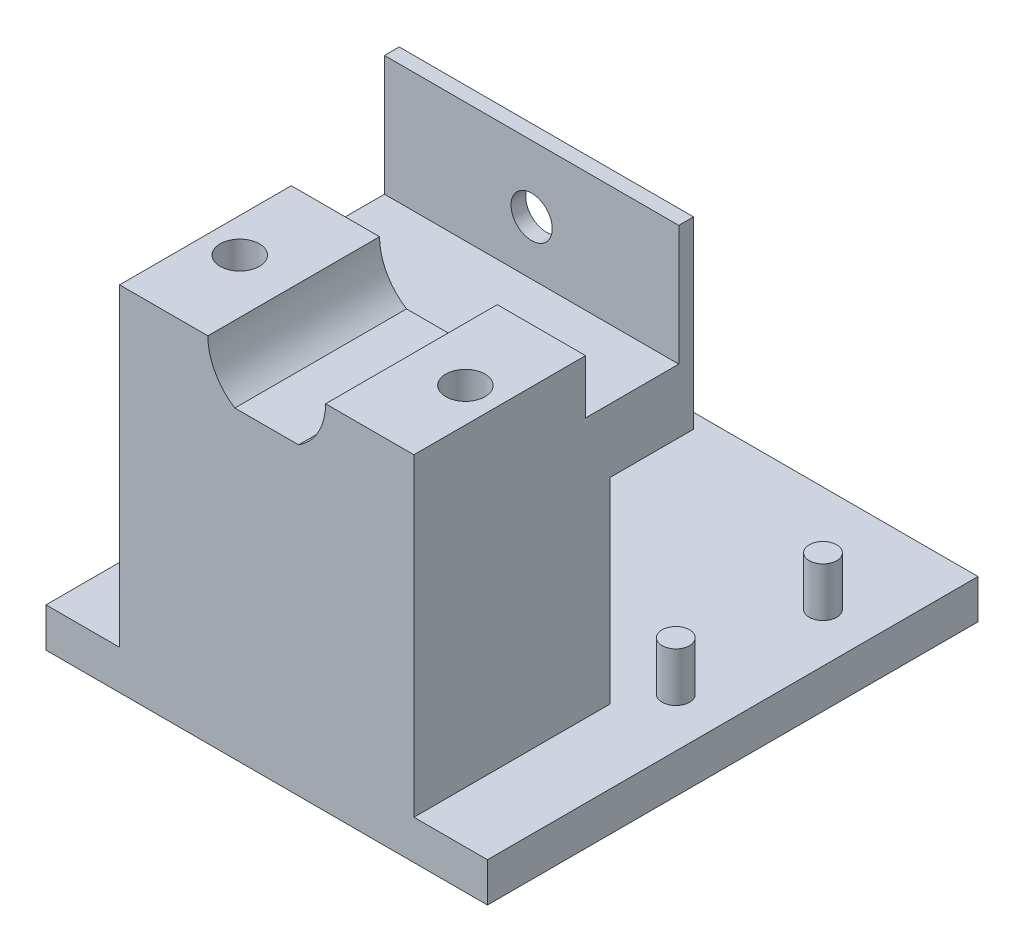
from build123d import *

# Parameters (mm, degrees)
SKETCH_2_W          = 50
SKETCH_2_H          = 4
EXTRUDE_2_DEPTH     = 22.5
SKETCH_15_R         = 1.4
EXTRUDE_8_DEPTH     = 5
SKETCH_3_W          = 30
SKETCH_3_H          = 20
EXTRUDE_4_DEPTH     = 20
EXTRUDE_9_DEPTH     = 17.5
EXTRUDE_10_DEPTH    = 15
CUT_EXTRUDE_1_REACH = 58.089
SKETCH_19_R         = 2.1
SKETCH_20_R         = 2
CUT_EXTRUDE_2_DEPTH = 10


with BuildPart() as part:
    # 草圖2 → 填料-伸長2 (new, symmetric)
    with BuildSketch(Plane(origin=(0, 0, 0), x_dir=(0, 0, -1), z_dir=(1, 0, 0))):
        with Locations((25, 2)):
            Rectangle(SKETCH_2_W, SKETCH_2_H)
    extrude(amount=EXTRUDE_2_DEPTH, both=True)

    # 草圖15 → 填料-伸長8 (add)
    with BuildSketch(Plane(origin=(0, 4, 0), x_dir=(1, 0, 0), z_dir=(0, 1, 0))):
        with Locations(Location((17.5, 39.2, 0), (0, 0, 90))):
            Circle(SKETCH_15_R)
        with Locations(Location((17.5, 24.2, 0), (0, 0, 90))):
            Circle(SKETCH_15_R)
    extrude(amount=EXTRUDE_8_DEPTH)

    # 草圖3 → 填料-伸長4 (add)
    with BuildSketch(Plane(origin=(0, 4, 0), x_dir=(1, 0, 0), z_dir=(0, 1, 0))):
        with Locations((0, 10)):
            Rectangle(SKETCH_3_W, SKETCH_3_H)
    extrude(amount=EXTRUDE_4_DEPTH)

    # 草圖16 → 填料-伸長9 (add)
    with BuildSketch(Plane(origin=(0, 0, 0), x_dir=(-1, 0, 0), z_dir=(0, 0, -1))):
        with BuildLine():
            Line((-15, 24), (-15, 36.000002525))
            Line((-15, 36.000002525), (-6, 36.000002525))
            ThreePointArc((-6, 36.000002525), (-5.267141914, 33.146824473), (-3.25, 31.000002525))
            Line((-3.25, 31.000002525), (3.25, 31.000002525))
            ThreePointArc((3.25, 31.000002525), (5.267141914, 33.146824473), (6, 36.000002525))
            Line((6, 36.000002525), (15, 36.000002525))
            Line((15, 36.000002525), (15, 24))
            Line((15, 24), (-15, 24))
        make_face()
    extrude(amount=EXTRUDE_9_DEPTH)

    # 草圖18 → 填料-伸長10 (add, symmetric)
    with BuildSketch(Plane(origin=(0, 0, 0), x_dir=(0, 0, -1), z_dir=(1, 0, 0))):
        Polygon((17.5, 24), (28.5, 24), (28.5, 42.748788628), (27, 42.748788628), (27, 30.5), (17.5, 30.5), align=None)
    extrude(amount=EXTRUDE_10_DEPTH, both=True)

    # 草圖19 → 除料-伸長1 (cut, up to next)
    with BuildSketch(Plane(origin=(0, 0, -28.5), x_dir=(-1, 0, 0), z_dir=(0, 0, -1)), mode=Mode.PRIVATE) as cut_extrude_1_sk1:
        with Locations((0, 36.000002505)):
            Circle(SKETCH_19_R)
    cut_extrude_1_tool1 = extrude(cut_extrude_1_sk1.sketch, amount=-CUT_EXTRUDE_1_REACH, mode=Mode.PRIVATE) & part.part
    add(cut_extrude_1_tool1.solids().sort_by_distance((0, 36.000003, -28.5))[0], mode=Mode.SUBTRACT)

    # 草圖20 → 除料-伸長2 (cut)
    with BuildSketch(Plane(origin=(0, 36.000002525, 0), x_dir=(1, 0, 0), z_dir=(0, 1, 0))):
        with Locations(Location((-11.5, 8.75, 0), (0, 0, 180))):
            Circle(SKETCH_20_R)
        with Locations(Location((11.5, 8.75, 0), (0, 0, 180))):
            Circle(SKETCH_20_R)
    extrude(amount=-CUT_EXTRUDE_2_DEPTH, mode=Mode.SUBTRACT)


solid = part.part
